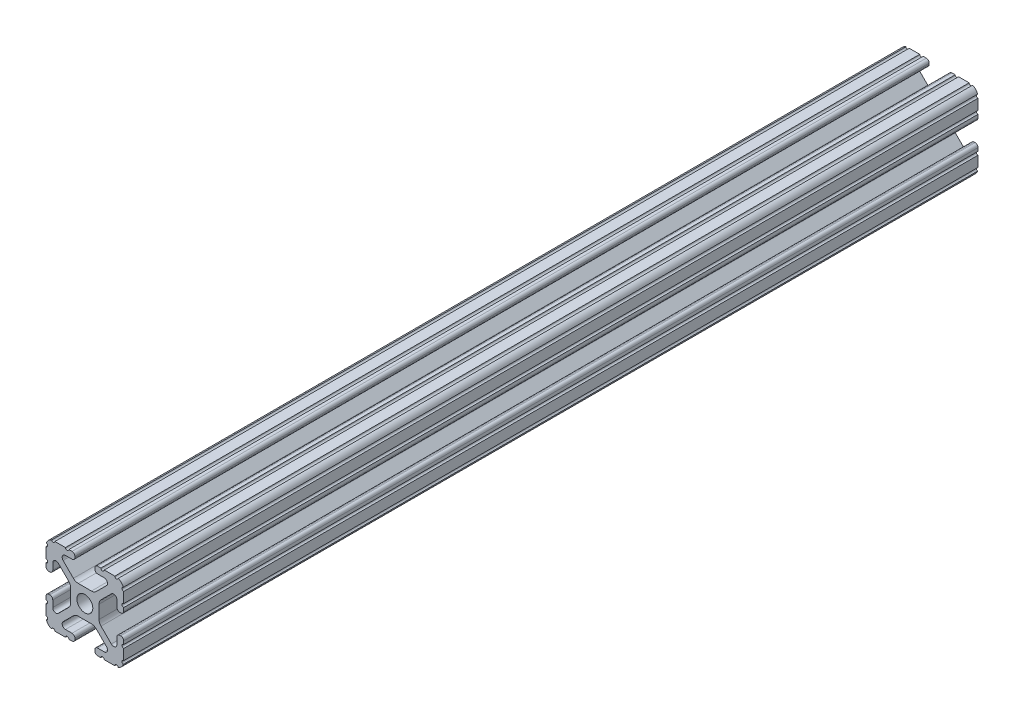
from build123d import *

# Parameters (mm, degrees)
BOSS_EXTRUDE1_DEPTH     = 139.7
CUT_EXTRUDE1_DEPTH      = 141.849813631
CUT_EXTRUDE1_DEPTH_BACK = 141.849813631
SKETCH5_R               = 0.55245


with BuildPart() as part:
    # Sketch4 → Boss-Extrude1 (new, symmetric)
    with BuildSketch(Plane.XY):
        with BuildLine():
            Line((4.190365, -12.7), (10.11729625, -12.7))
            ThreePointArc((10.11729625, -12.7), (11.943543585, -11.943543585), (12.7, -10.11729625))
            Line((12.7, -10.11729625), (12.7, -4.190365))
            ThreePointArc((12.7, -4.190365), (12.42492494, -3.52627506), (11.760835, -3.2512))
            Line((11.760835, -3.2512), (11.429365, -3.2512))
            ThreePointArc((11.429365, -3.2512), (10.76527506, -3.52627506), (10.4902, -4.190365))
            Line((10.4902, -4.190365), (10.4902, -6.348478019))
            ThreePointArc((10.4902, -6.348478019), (9.830707141, -7.335478831), (8.666460301, -7.103895736))
            Line((8.666460301, -7.103895736), (5.299899128, -3.737334563))
            ThreePointArc((5.299899128, -3.737334563), (4.817571085, -3.015479634), (4.6482, -2.16399369))
            Line((4.6482, -2.16399369), (4.6482, 0))
            Line((4.6482, 0), (2.6035, 0))
            ThreePointArc((2.6035, 0), (1.840952505, -1.840952505), (0, -2.6035))
            Line((0, -2.6035), (0, -4.6482))
            Line((0, -4.6482), (2.16399369, -4.6482))
            ThreePointArc((2.16399369, -4.6482), (3.015479634, -4.817571085), (3.737334563, -5.299899128))
            Line((3.737334563, -5.299899128), (7.103895736, -8.666460301))
            ThreePointArc((7.103895736, -8.666460301), (7.335478831, -9.830707141), (6.348478019, -10.4902))
            Line((6.348478019, -10.4902), (4.190365, -10.4902))
            ThreePointArc((4.190365, -10.4902), (3.52627506, -10.76527506), (3.2512, -11.429365))
            Line((3.2512, -11.429365), (3.2512, -11.760835))
            ThreePointArc((3.2512, -11.760835), (3.52627506, -12.42492494), (4.190365, -12.7))
        make_face()
    extrude(amount=BOSS_EXTRUDE1_DEPTH, both=True)

    # Sketch5 → Cut-Extrude1 (cut, two sides: drawn at the far end of the back side and taken through both)
    with BuildSketch(Plane.XY.offset(-CUT_EXTRUDE1_DEPTH_BACK)):
        with Locations((10.356153152, -12.7)):
            Circle(SKETCH5_R)
        with Locations((5.796028019, -12.7)):
            Circle(SKETCH5_R)
        with Locations((12.7, -10.356153152)):
            Circle(SKETCH5_R)
        with Locations((12.7, -5.796028019)):
            Circle(SKETCH5_R)
    extrude(amount=CUT_EXTRUDE1_DEPTH + CUT_EXTRUDE1_DEPTH_BACK, mode=Mode.SUBTRACT)

    # Mirror1: part across plane


with BuildPart() as part_1:
    add(part.part)
    add(part.part.mirror(Plane(origin=(0, 0, 0), x_dir=(0, 0, 1), z_dir=(1, 0, 0))))

    # Mirror2: part across plane


with BuildPart() as part_2:
    add(part_1.part)
    add(part_1.part.mirror(Plane.ZX))


solid = part_2.part
